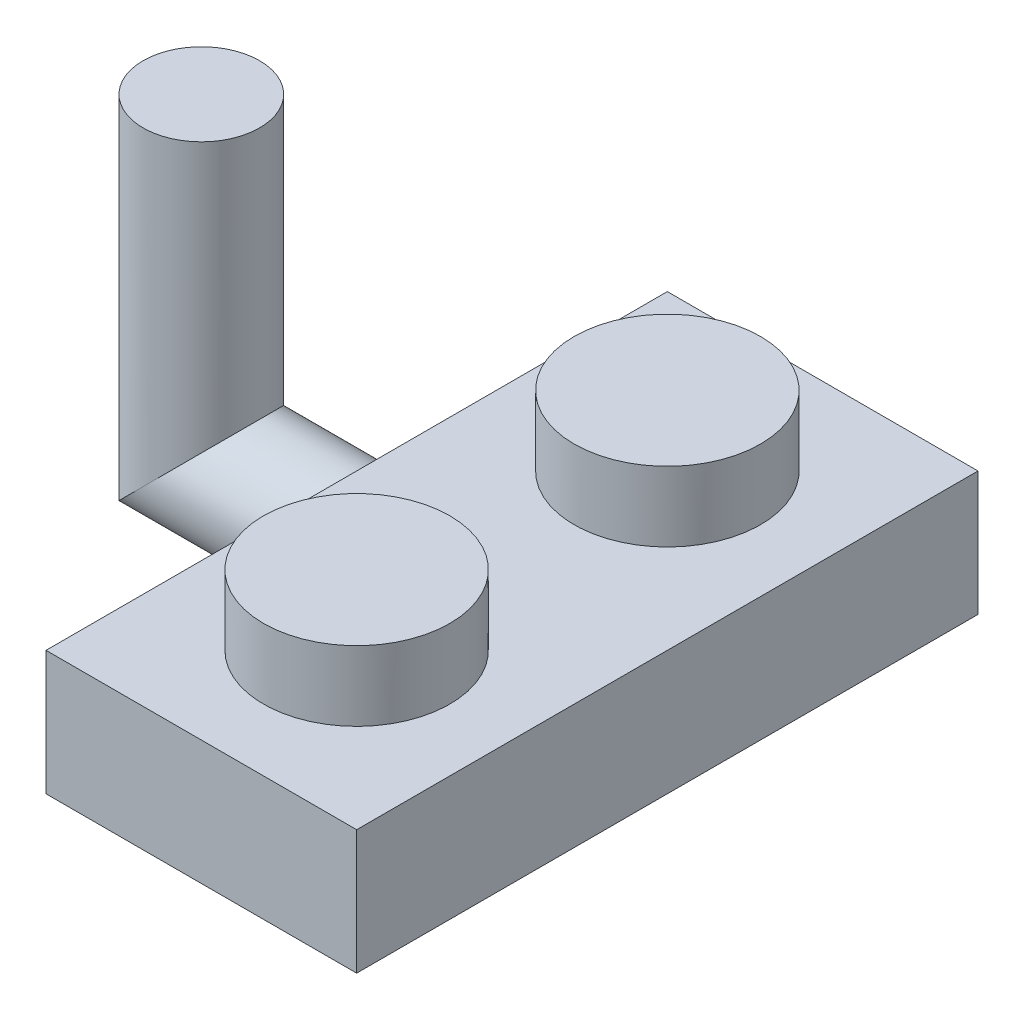
from build123d import *

# Parameters (mm, degrees)
SKETCH1_W           = 8
SKETCH1_H           = 3.2
BOSS_EXTRUDE1_DEPTH = 16
SKETCH2_W           = 4.8
SKETCH2_H           = 12.8
CUT_EXTRUDE1_DEPTH  = 1.8
SKETCH3_R           = 2.4
BOSS_EXTRUDE2_DEPTH = 1.8
SKETCH4_R           = 1.6
BOSS_EXTRUDE3_DEPTH = 1.8
SWEEP1_PROFILE_R    = 1.5


with BuildPart() as part:
    # Sketch1 → Boss-Extrude1 (new body)
    with BuildSketch(Plane.XY):
        with Locations((4, 1.6)):
            Rectangle(SKETCH1_W, SKETCH1_H)
    extrude(amount=BOSS_EXTRUDE1_DEPTH)

    # Sketch2 → Cut-Extrude1 (cut)
    with BuildSketch(Plane.XZ):
        with Locations((4, 8)):
            Rectangle(SKETCH2_W, SKETCH2_H)
    extrude(amount=-CUT_EXTRUDE1_DEPTH, mode=Mode.SUBTRACT)

    # Sketch3 → Boss-Extrude2 (add)
    with BuildSketch(Plane(origin=(0, 3.2, 0), x_dir=(1, 0, 0), z_dir=(0, 1, 0))):
        with Locations((4, -4)):
            Circle(SKETCH3_R)
        with Locations((4, -12)):
            Circle(SKETCH3_R)
    extrude(amount=BOSS_EXTRUDE2_DEPTH)

    # Sketch4 → Boss-Extrude3 (add)
    with BuildSketch(Plane.XZ.offset(-1.8)):
        with Locations((4, 8)):
            Circle(SKETCH4_R)
    extrude(amount=BOSS_EXTRUDE3_DEPTH)

    # Sweep1: sweep along a path in Sketch6
    with BuildLine(Plane.XY.offset(8)) as sweep1_path:
        Line((0, 1.6), (-4, 1.6))
        Line((-4, 1.6), (-4, 9.6))
    # Sweep1 profile (on start of the path) → Sweep1 (sweep)
    with BuildSketch(Plane(origin=(0, 1.6, 8), x_dir=(0, -1, 0), z_dir=(-1, 0, 0))):
        Circle(SWEEP1_PROFILE_R)
    sweep(path=sweep1_path.line, transition=Transition.RIGHT)


solid = part.part
